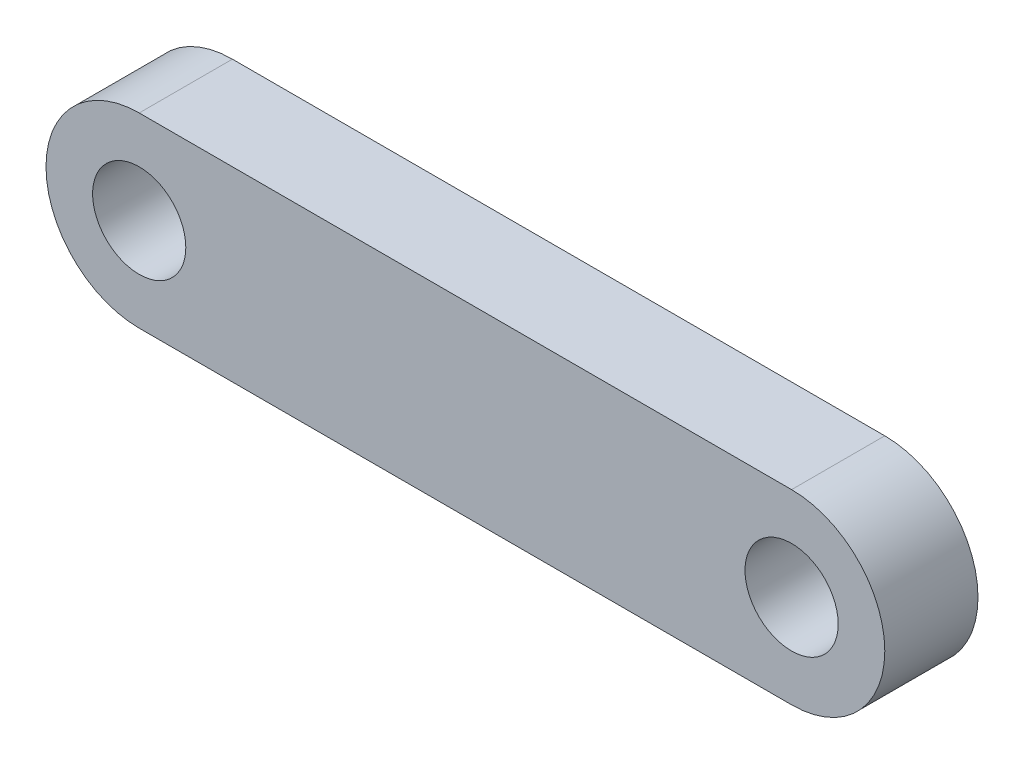
from build123d import *

# Parameters (mm, degrees)
EXTRUDE_1_DEPTH     = 10
SKETCH_2_R          = 5
CUT_EXTRUDE_1_DEPTH = 10
SKETCH_3_R          = 5
CUT_EXTRUDE_2_DEPTH = 10


with BuildPart() as part:
    # 草图1 → 凸台-拉伸1 (new body)
    with BuildSketch(Plane.XY):
        with BuildLine():
            Line((0, -10), (70, -10))
            ThreePointArc((70, -10), (80, 0), (70, 10))
            Line((70, 10), (0, 10))
            ThreePointArc((0, 10), (-10, 0), (0, -10))
        make_face()
    extrude(amount=EXTRUDE_1_DEPTH)

    # 草图2 → 切除-拉伸1 (cut)
    with BuildSketch(Plane.XY.offset(10)):
        Circle(SKETCH_2_R)
    extrude(amount=-CUT_EXTRUDE_1_DEPTH, mode=Mode.SUBTRACT)

    # 草图3 → 切除-拉伸2 (cut)
    with BuildSketch(Plane.XY.offset(10)):
        with Locations((70, 0)):
            Circle(SKETCH_3_R)
    extrude(amount=-CUT_EXTRUDE_2_DEPTH, mode=Mode.SUBTRACT)


solid = part.part
